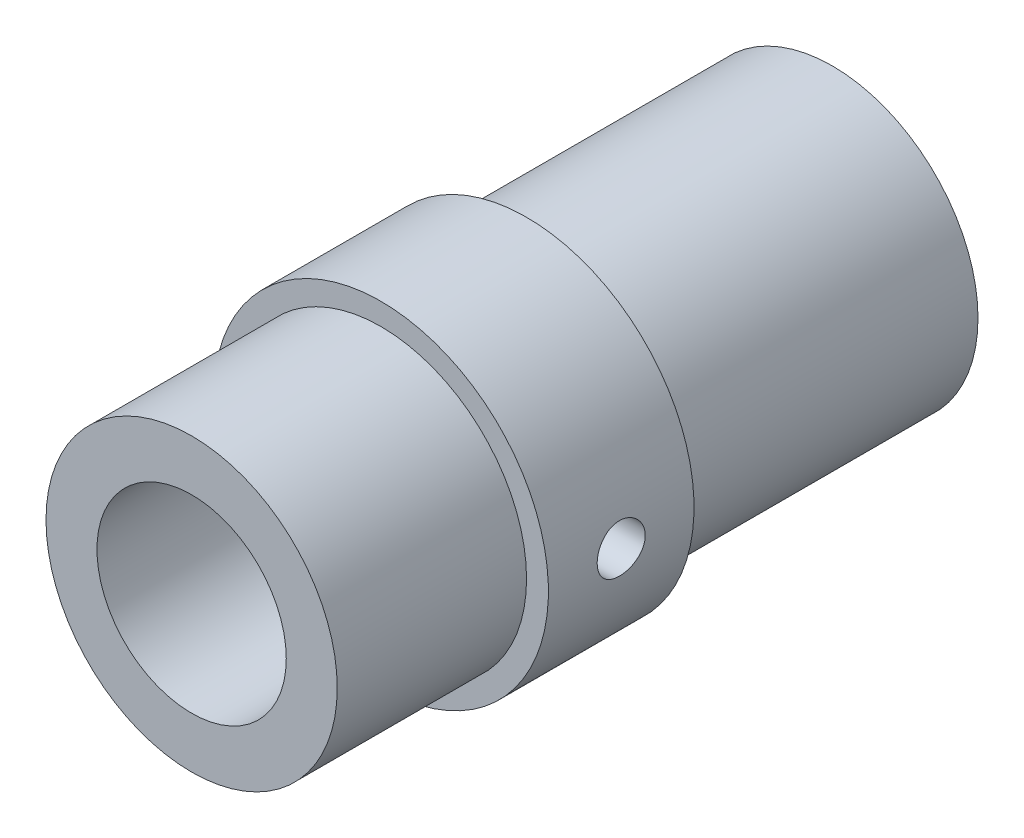
from build123d import *

# Parameters (mm, degrees)
SKETCH_1_R          = 10
EXTRUDE_1_DEPTH     = 44
SKETCH_2_R          = 6.5
CUT_EXTRUDE_1_DEPTH = 27
M3X0_51_D           = 2.5
M3X0_51_DEPTH       = 8.5
M3X0_51_TIP         = 0.751075774
SKETCH_10_R         = 11.5
SKETCH_10_R_2       = 10
EXTRUDE_2_DEPTH     = 10
M4X0_71_D           = 3.3


with BuildPart() as part:
    # Эскиз1 → Бобышка-Вытянуть1 (new body)
    with BuildSketch(Plane.XY):
        Circle(SKETCH_1_R)
    extrude(amount=EXTRUDE_1_DEPTH)

    # Эскиз2 → Вырез-Вытянуть1 (cut)
    with BuildSketch(Plane.XY.offset(44)):
        Circle(SKETCH_2_R)
    extrude(amount=-CUT_EXTRUDE_1_DEPTH, mode=Mode.SUBTRACT)

    # Отверстие обработанное метчиком M3x0.51
    with Locations(Plane(origin=(0, 0, 0), x_dir=(-1, 0, 0), z_dir=(0, 0, -1))):
        with Locations((-4.242640687, 4.242640687), (4.242640687, 4.242640687), (4.242640687, -4.242640687), (-4.242640687, -4.242640687)):
            Hole(M3X0_51_D / 2, depth=M3X0_51_DEPTH)
            with Locations((0, 0, -(M3X0_51_DEPTH + M3X0_51_TIP / 2))):  # 118° drill point
                Cone(0, M3X0_51_D / 2, M3X0_51_TIP, mode=Mode.SUBTRACT)

    # Эскиз10 → Бобышка-Вытянуть2 (add)
    with BuildSketch(Plane(origin=(0, 0, 21), x_dir=(-1, 0, 0), z_dir=(0, 0, -1))):
        Circle(SKETCH_10_R)
        Circle(SKETCH_10_R_2, mode=Mode.SUBTRACT)
    extrude(amount=-EXTRUDE_2_DEPTH)

    # Отверстие обработанное метчиком M4x0.71 (through all)
    with Locations(Plane(origin=(-11.5, 0, 0), x_dir=(0, 0, -1), z_dir=(-1, 0, 0))):
        with Locations((-26, 0)):
            Hole(M4X0_71_D / 2)


solid = part.part
